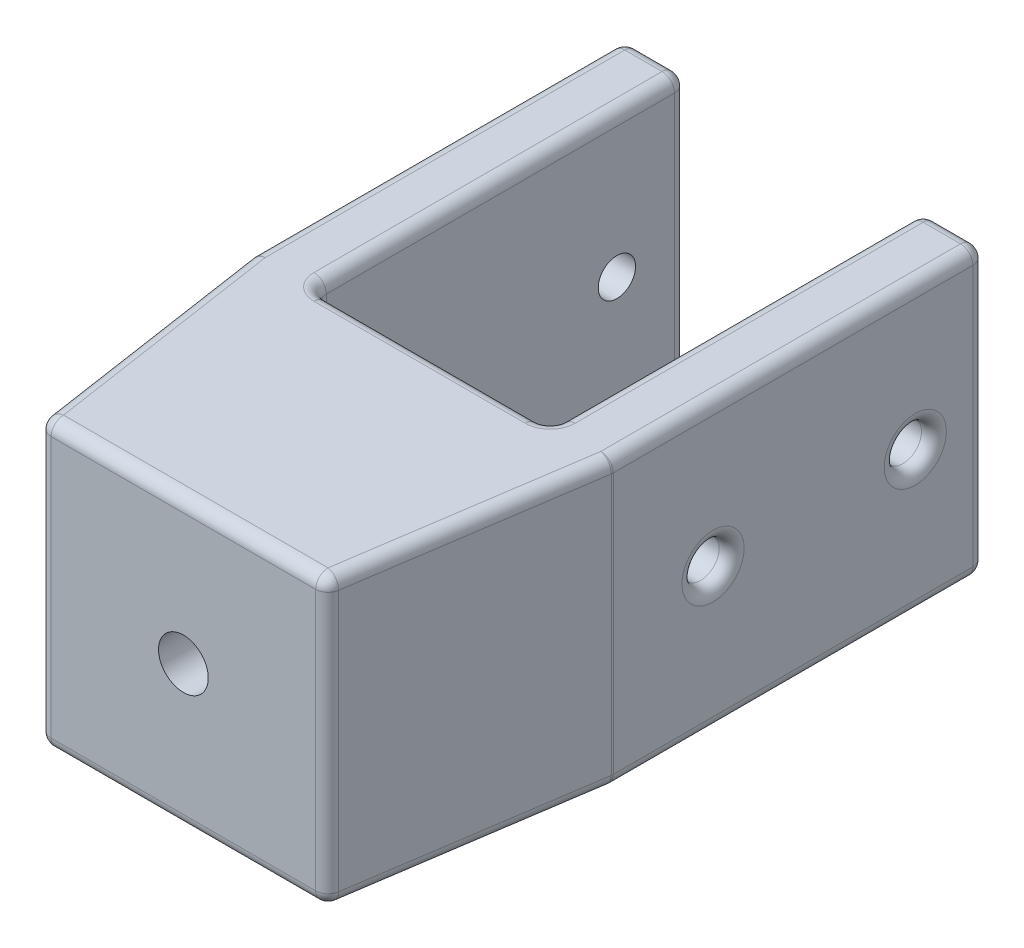
from build123d import *

# Parameters (mm, degrees)
SKETCH2_W           = 23
SKETCH2_H           = 23
BOSS_EXTRUDE1_DEPTH = 5
SKETCH2_3_W         = 23
SKETCH2_3_H         = 23
BOSS_EXTRUDE2_DEPTH = 45
SKETCH4_W           = 3
SKETCH4_H           = 30
BOSS_EXTRUDE3_DEPTH = 23
SKETCH4_4_W         = 19
SKETCH4_4_H         = 30
CUT_EXTRUDE1_DEPTH  = 50
SKETCH6_R           = 4
SKETCH6_R_2         = 2
CUT_EXTRUDE3_DEPTH  = 15
SKETCH6_2_R         = 2
CUT_EXTRUDE4_DEPTH  = 36.249113464
SKETCH7_R           = 1.5
CUT_EXTRUDE5_DEPTH  = 55.756278179
FILLET2_R           = 1
FILLET3_R           = 1


with BuildPart() as part:
    # Sketch2 → Boss-Extrude1 (new body)
    with BuildSketch(Plane.XY):
        Rectangle(SKETCH2_W, SKETCH2_H)
    extrude(amount=BOSS_EXTRUDE1_DEPTH)

    # Sketch2<3> → Boss-Extrude2 (add)
    with BuildSketch(Plane.XY):
        Rectangle(SKETCH2_3_W, SKETCH2_3_H)
    extrude(amount=-BOSS_EXTRUDE2_DEPTH)

    # Sketch4 → Boss-Extrude3 (add)
    with BuildSketch(Plane(origin=(0, 11.5, 0), x_dir=(1, 0, 0), z_dir=(0, 1, 0))):
        with Locations((13, 30)):
            Rectangle(SKETCH4_W, SKETCH4_H)
        Polygon((11.5, 15), (11.5, -5), (14.5, 15), align=None)
        with Locations((-13, 30)):
            Rectangle(SKETCH4_W, SKETCH4_H)
        Polygon((-11.5, 15), (-14.5, 15), (-11.5, -5), align=None)
    extrude(amount=-BOSS_EXTRUDE3_DEPTH)

    # Sketch4<4> → Cut-Extrude1 (cut)
    with BuildSketch(Plane(origin=(0, 11.5, 0), x_dir=(1, 0, 0), z_dir=(0, 1, 0))):
        with Locations((0, 30)):
            Rectangle(SKETCH4_4_W, SKETCH4_4_H)
    extrude(amount=-CUT_EXTRUDE1_DEPTH, mode=Mode.SUBTRACT)

    # Sketch6 → Cut-Extrude3 (cut)
    with BuildSketch(Plane(origin=(0, 0, -15), x_dir=(-1, 0, 0), z_dir=(0, 0, -1))):
        Circle(SKETCH6_R)
        Circle(SKETCH6_R_2, mode=Mode.SUBTRACT)
    extrude(amount=-CUT_EXTRUDE3_DEPTH, mode=Mode.SUBTRACT)

    # Sketch6<2> → Cut-Extrude4 (cut, through all)
    with BuildSketch(Plane(origin=(0, 0, -15), x_dir=(-1, 0, 0), z_dir=(0, 0, -1))):
        Circle(SKETCH6_2_R)
    extrude(amount=-CUT_EXTRUDE4_DEPTH, mode=Mode.SUBTRACT)

    # Sketch7 → Cut-Extrude5 (cut, through all)
    with BuildSketch(Plane.ZY.offset(14.5)):
        with Locations((-39.366974098, 0)):
            Circle(SKETCH7_R)
        with Locations((-23.098715856, 0)):
            Circle(SKETCH7_R)
    extrude(amount=-CUT_EXTRUDE5_DEPTH, mode=Mode.SUBTRACT)

    # Fillet2
    fillet2_edges = [part.edges().sort_by_distance(p)[0] for p in [
        (11.5, 0, 5),
        (-12, -11.5, -45),
        (0, 11.5, 5),
        (-12, 11.5, -45),
        (-11.5, 0, 5),
        (14.5, 11.5, -30),
        (13, -11.5, -5),
        (14.5, 0, -15),
        (13, 11.5, -5),
        (14.5, 0, -45),
        (14.5, -11.5, -30),
        (-13, 11.5, -5),
        (-14.5, -11.5, -30),
        (-14.5, 0, -15),
        (-14.5, 11.5, -30),
        (-14.5, 0, -45),
        (-13, -11.5, -5),
        (12, -11.5, -45),
        (12, 11.5, -45),
        (9.5, 0, -45),
        (-9.5, 0, -45),
        (0, -11.5, -15),
        (9.5, 0, -15),
        (-9.5, 0, -15),
        (-9.5, 11.5, -30),
        (9.5, -11.5, -30),
        (-9.5, -11.5, -30),
        (0, 11.5, -15),
        (0, -11.5, 5),
        (9.5, 11.5, -30),
    ]]
    fillet(fillet2_edges, radius=FILLET2_R)

    # Fillet3
    fillet3_edges = [part.edges().sort_by_distance(p)[0] for p in [
        (4, 0, -15),
        (2, 0, 0),
        (14.5, 0, -40.866974098),
        (-14.5, 0, -40.866974098),
        (14.5, 0, -24.598715856),
        (-14.5, 0, -24.598715856),
    ]]
    fillet(fillet3_edges, radius=FILLET3_R)


solid = part.part
